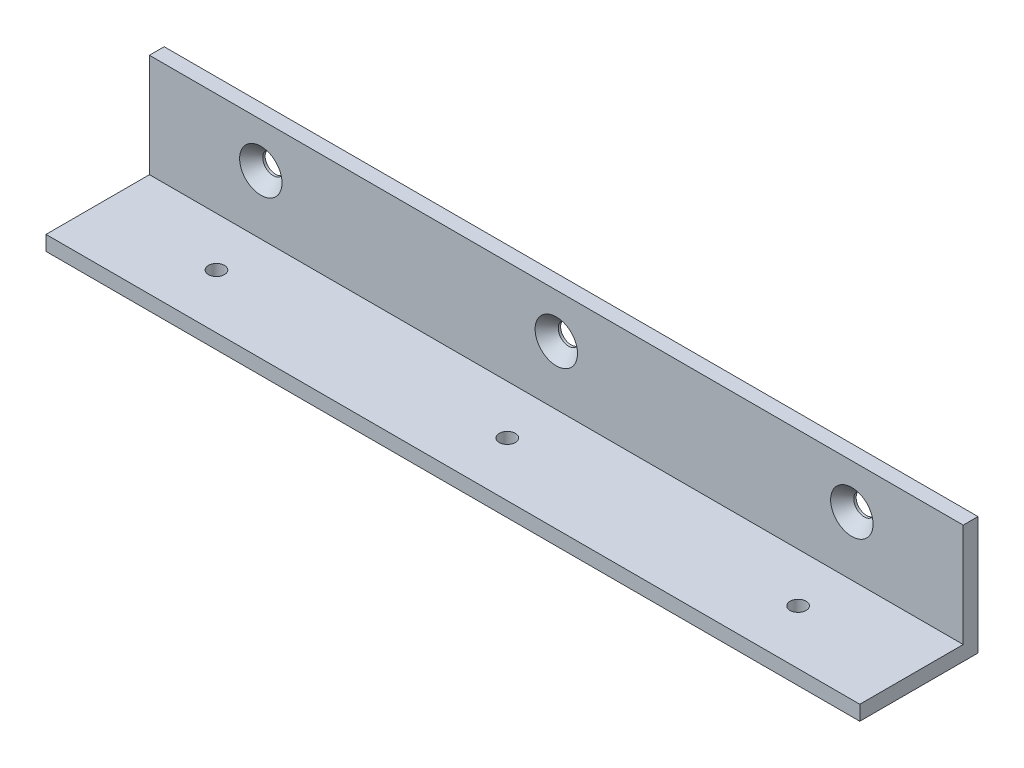
from build123d import *

# Parameters (mm, degrees)
SKETCH1_W                                     = 174.879
SKETCH1_H                                     = 25.4
BOSS_EXTRUDE1_DEPTH                           = 3.175
SKETCH2_W                                     = 174.879
SKETCH2_H                                     = 3.175
BOSS_EXTRUDE2_DEPTH                           = 22.225
F_8_32_TAPPED_HOLE1_D                         = 3.4544
F_8_32_TAPPED_HOLE1_DEPTH                     = 10.668
F_8_32_TAPPED_HOLE1_TIP                       = 1.037806461
CSK_FOR_8_FLAT_HEAD_SOCKET_CAP_SCREW1_A_COUNT = 2
CSK_FOR_8_FLAT_HEAD_SOCKET_CAP_SCREW1_A_PITCH = 63.5
CSK_FOR_8_FLAT_HEAD_SOCKET_CAP_SCRE_2_COUNT   = 2
CSK_FOR_8_FLAT_HEAD_SOCKET_CAP_SCRE_2_PITCH   = 127


with BuildPart() as part:
    # Sketch1 → Boss-Extrude1 (new body)
    with BuildSketch(Plane(origin=(0, 0, 0), x_dir=(1, 0, 0), z_dir=(0, 1, 0))):
        Rectangle(SKETCH1_W, SKETCH1_H)
    extrude(amount=BOSS_EXTRUDE1_DEPTH)

    # Sketch2 → Boss-Extrude2 (add)
    with BuildSketch(Plane(origin=(0, 3.175, 0), x_dir=(1, 0, 0), z_dir=(0, 1, 0))):
        with Locations((0, 11.1125)):
            Rectangle(SKETCH2_W, SKETCH2_H)
    extrude(amount=BOSS_EXTRUDE2_DEPTH)

    # #8-32 Tapped Hole1
    with Locations(Plane(origin=(0, 3.175, 0), x_dir=(-1, 0, 0), z_dir=(0, 1, 0))):
        with Locations((62.5, 1.016), (0, 1.016), (-62.5, 1.016)):
            Hole(F_8_32_TAPPED_HOLE1_D / 2, depth=F_8_32_TAPPED_HOLE1_DEPTH)
            with Locations((0, 0, -(F_8_32_TAPPED_HOLE1_DEPTH + F_8_32_TAPPED_HOLE1_TIP / 2))):  # 118° drill point
                Cone(0, F_8_32_TAPPED_HOLE1_D / 2, F_8_32_TAPPED_HOLE1_TIP, mode=Mode.SUBTRACT)

    # Sketch6 → CSK for #8 Flat Head Socket Cap Screw1 (revolve, cut)
    with BuildSketch(Plane(origin=(-63.5, 15.875, -9.525), x_dir=(0, -1, 0), z_dir=(1, 0, 0))):
        Polygon((0, 0), (0, 3.175), (2.2479, 3.175), (2.2479, 2.658961536), (4.5593, 0), align=None)
    csk_for_8_flat_head_socket_cap_screw1 = revolve(axis=Axis((-63.5, 15.875, -3.175), (0, 0, -1)), mode=Mode.SUBTRACT)

    # CSK for #8 Flat Head Socket Cap Screw1 a: CSK for #8 Flat Head Socket Cap Screw1 ×2
    with Locations(*[(i * CSK_FOR_8_FLAT_HEAD_SOCKET_CAP_SCREW1_A_PITCH, 0, 0) for i in range(1, CSK_FOR_8_FLAT_HEAD_SOCKET_CAP_SCREW1_A_COUNT)]):
        add(csk_for_8_flat_head_socket_cap_screw1, mode=Mode.SUBTRACT)

    # CSK for _8 Flat Head Socket Cap Scre 2: CSK for #8 Flat Head Socket Cap Screw1 ×2
    with Locations(*[(i * CSK_FOR_8_FLAT_HEAD_SOCKET_CAP_SCRE_2_PITCH, 0, 0) for i in range(1, CSK_FOR_8_FLAT_HEAD_SOCKET_CAP_SCRE_2_COUNT)]):
        add(csk_for_8_flat_head_socket_cap_screw1, mode=Mode.SUBTRACT)


solid = part.part
